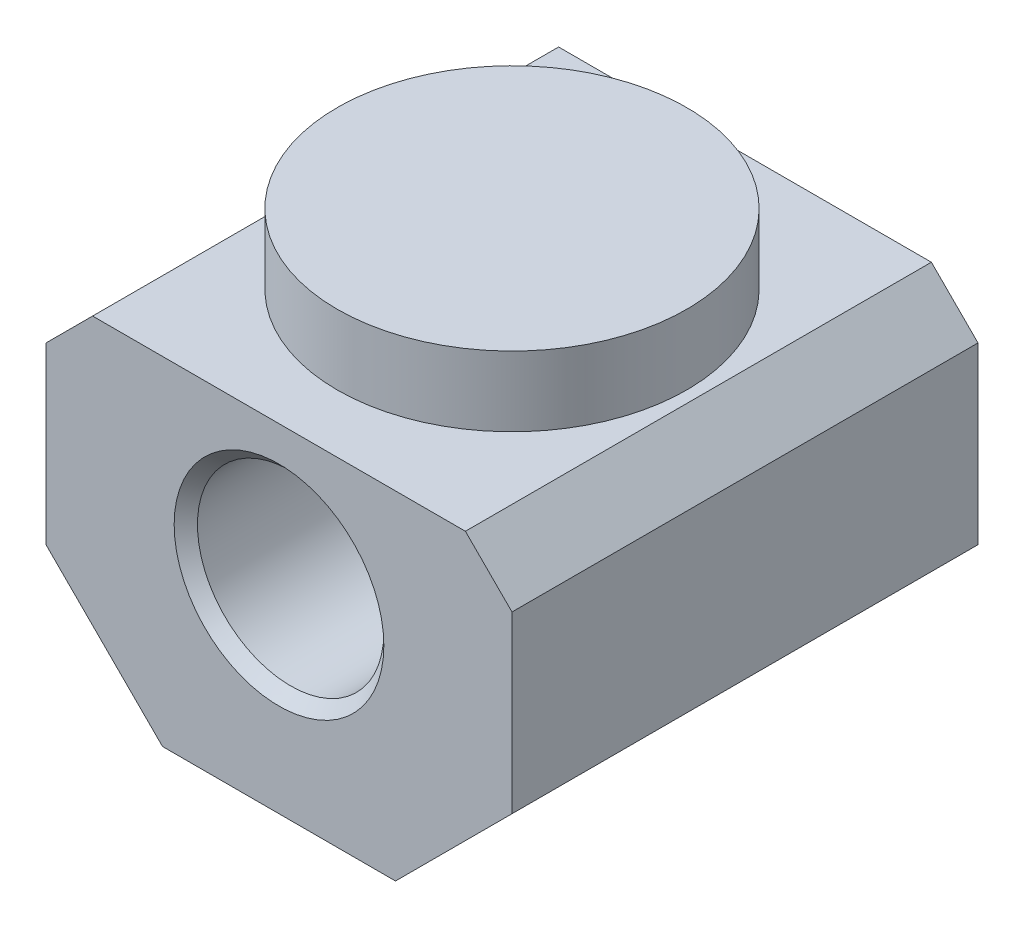
from build123d import *

# Parameters (mm, degrees)
SKETCH1_W                = 20
SKETCH1_H                = 20
BOSS_EXTRUDE1_DEPTH      = 14.5
SKETCH2_R                = 7.5
BOSS_EXTRUDE2_DEPTH      = 3
F_8_0_8_DIAMETER_HOLE1_D = 8
CHAMFER1_SIZE            = 5
CHAMFER2_SIZE            = 2
CHAMFER3_SIZE            = 0.5


with BuildPart() as part:
    # Sketch1 → Boss-Extrude1 (new body)
    with BuildSketch(Plane(origin=(0, 0, 0), x_dir=(1, 0, 0), z_dir=(0, 1, 0))):
        Rectangle(SKETCH1_W, SKETCH1_H)
    extrude(amount=-BOSS_EXTRUDE1_DEPTH)

    # Sketch2 → Boss-Extrude2 (add)
    with BuildSketch(Plane(origin=(0, 0, 0), x_dir=(-1, 0, 0), z_dir=(0, 1, 0))):
        with Locations(Location((0, 0, 0), (0, 0, 90))):
            Circle(SKETCH2_R)
    extrude(amount=BOSS_EXTRUDE2_DEPTH)

    # Ø8.0 (8) Diameter Hole1 (through all)
    with Locations(Plane.XY.offset(10)):
        with Locations((0, -6)):
            Hole(F_8_0_8_DIAMETER_HOLE1_D / 2)

    # Chamfer1
    chamfer1_edges = [part.edges().sort_by_distance(p)[0] for p in [
        (-10, -14.5, 0),
        (10, -14.5, 0),
    ]]
    chamfer(chamfer1_edges, length=CHAMFER1_SIZE)

    # Chamfer2
    chamfer2_edges = [part.edges().sort_by_distance(p)[0] for p in [
        (-10, 0, 0),
        (10, 0, 0),
    ]]
    chamfer(chamfer2_edges, length=CHAMFER2_SIZE)

    # Chamfer3
    chamfer3_edges = [part.edges().sort_by_distance(p)[0] for p in [
        (4, -6, 10),
        (4, -6, -10),
    ]]
    chamfer(chamfer3_edges, length=CHAMFER3_SIZE)


solid = part.part
